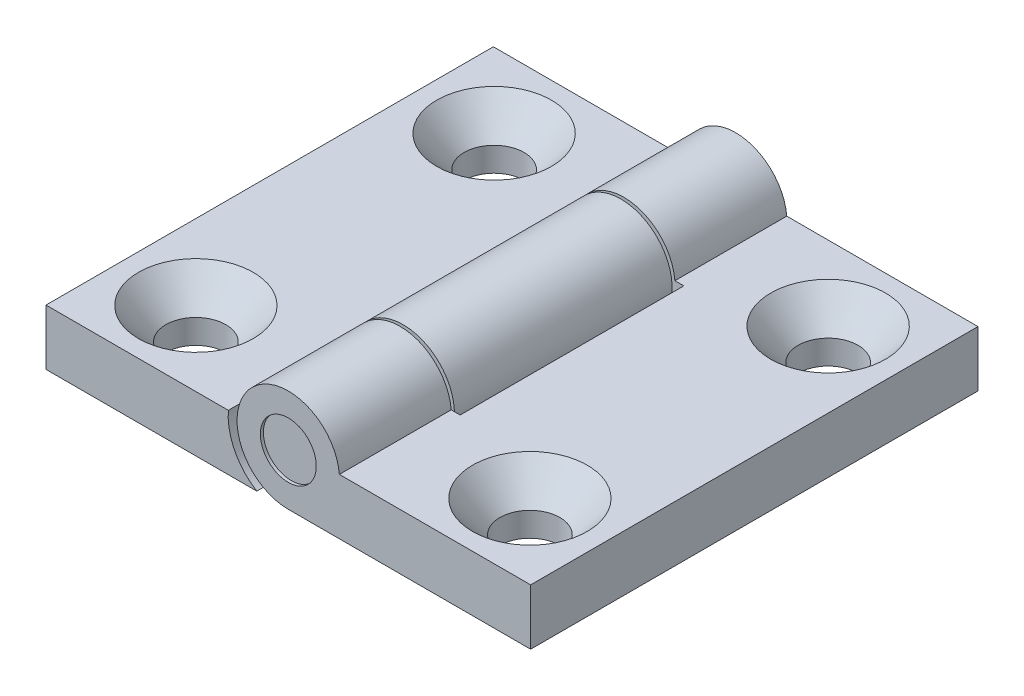
from build123d import *
from build123d.topology import SkipClean

# Parameters (mm, degrees)
SKETCH1_R                                    = 2.38125
EXTRUDE1_DEPTH                               = 19.05
CUT_EXTRUDE1_DEPTH                           = 9.525
CUT_EXTRUDE2_DEPTH                           = 9.525
SKETCH4_W                                    = 10.221376894
SKETCH4_H                                    = 0.254
CUT_EXTRUDE4_DEPTH                           = 30.41162411
SKETCH5_R                                    = 2.38125
EXTRUDE2_DEPTH                               = 18.796
CSK_FOR_10_FLAT_HEAD_MACHINE_SCREW1_AT_COUNT = 2
CSK_FOR_10_FLAT_HEAD_MACHINE_SCREW1_AT_PITCH = 25.4
CSK_FOR_10_FLAT_HEAD_MACHINE_SCREW1_2_COUNT  = 2
CSK_FOR_10_FLAT_HEAD_MACHINE_SCREW1_2_PITCH  = 38.137235138
CSK_FOR_10_FLAT_HEAD_MACHINE_SCREW1_3_COUNT  = 2
CSK_FOR_10_FLAT_HEAD_MACHINE_SCREW1_3_PITCH  = 28.448


with BuildPart() as part:
    # Sketch1 → Extrude1 (new, symmetric)
    with BuildSketch(Plane.XY):
        with BuildLine():
            Line((4.348688447, 4.7498), (20.6375, 4.7498))
            Line((20.6375, 4.7498), (20.6375, 0))
            Line((20.6375, 0), (-20.6375, 0))
            Line((-20.6375, 0), (-20.6375, 4.7498))
            Line((-20.6375, 4.7498), (-4.348688447, 4.7498))
            ThreePointArc((-4.348688447, 4.7498), (0, 8.73125), (4.348688447, 4.7498))
        make_face()
        with Locations(Location((0, 4.365625, 0), (0, 0, 180))):
            Circle(SKETCH1_R, mode=Mode.SUBTRACT)
    extrude(amount=EXTRUDE1_DEPTH, both=True)

    # Sketch2 → Cut-Extrude1 (cut)
    with BuildSketch(Plane.XY.offset(19.05)):
        with BuildLine():
            Line((-5.110688447, 4.7498), (-4.348688447, 4.7498))
            ThreePointArc((-4.348688447, 4.7498), (-3.219925902, 1.417615701), (0, 0))
            Line((0, 0), (-2.684780288, 0))
            ThreePointArc((-2.684780288, 0), (-4.564261518, 2.034478581), (-5.110688447, 4.7498))
        make_face()
    cut_extrude1 = extrude(amount=-CUT_EXTRUDE1_DEPTH, mode=Mode.SUBTRACT)

    # Mirror1: Cut-Extrude1 across plane
    add(cut_extrude1.mirror(Plane.XY), mode=Mode.SUBTRACT)

    # Sketch3 → Cut-Extrude2 (cut, symmetric)
    with SkipClean():  # the faces are left unmerged after this step: merging them gives an invalid solid
        with BuildSketch(Plane.XY):
            with BuildLine():
                Line((4.348688447, 4.7498), (5.110688447, 4.7498))
                ThreePointArc((5.110688447, 4.7498), (4.564261518, 2.034478581), (2.684780288, 0))
                Line((2.684780288, 0), (0, 0))
                ThreePointArc((0, 0), (3.219925902, 1.417615701), (4.348688447, 4.7498))
            make_face()
        extrude(amount=CUT_EXTRUDE2_DEPTH, both=True, mode=Mode.SUBTRACT)

    # Sketch4 → Cut-Extrude4 (cut, through all)
    with SkipClean():  # the faces are left unmerged after this step: merging them gives an invalid solid
        with BuildSketch(Plane(origin=(0, 0, 0), x_dir=(1, 0, 0), z_dir=(0, 1, 0))):
            with Locations((0, 9.398)):
                Rectangle(SKETCH4_W, SKETCH4_H)
            with Locations((0, -9.398)):
                Rectangle(SKETCH4_W, SKETCH4_H)
        extrude(amount=CUT_EXTRUDE4_DEPTH, mode=Mode.SUBTRACT)


with BuildPart() as cut_extrude4_piece_1:
    # of the separate pieces the step leaves, piece 1, a body of its own (cut_extrude4_pieces)
    add(part.part.solids().sort_by_distance((4.348688447, 4.7498, -19.05))[0])


with BuildPart() as cut_extrude4_piece_2:
    # of the separate pieces the step leaves, piece 2, a body of its own (cut_extrude4_pieces)
    add(part.part.solids().sort_by_distance((-4.348688447, 4.7498, -9.271))[0])

    # Sketch6 → CSK for #10 Flat Head Machine Screw1 (revolve, cut)
    with SkipClean():  # the faces are left unmerged after this step: merging them gives an invalid solid
        with BuildSketch(Plane(origin=(-14.224, 4.7498, -12.7), x_dir=(0, 0, 1), z_dir=(1, 0, 0))):
            Polygon((0, 0), (0, 4.7498), (2.5527, 4.7498), (2.5527, 2.688180894), (4.8895, 0), align=None)
        csk_for_10_flat_head_machine_screw1 = revolve(axis=Axis((-14.224, 11.0998, -12.7), (0, -1, 0)), mode=Mode.SUBTRACT)

    # CSK for #10 Flat Head Machine Screw1 at: CSK for #10 Flat Head Machine Screw1 ×2
    with SkipClean():  # the faces are left unmerged after this step: merging them gives an invalid solid
        with Locations(*[(0, 0, i * CSK_FOR_10_FLAT_HEAD_MACHINE_SCREW1_AT_PITCH) for i in range(1, CSK_FOR_10_FLAT_HEAD_MACHINE_SCREW1_AT_COUNT)]):
            add(csk_for_10_flat_head_machine_screw1, mode=Mode.SUBTRACT)


with BuildPart() as body_3:
    # Sketch5 → Extrude2 (new, symmetric)
    with BuildSketch(Plane.XY):
        with Locations((0, 4.365625)):
            Circle(SKETCH5_R)
    extrude(amount=EXTRUDE2_DEPTH, both=True)


with BuildPart() as cut_extrude4_piece_1_1:
    add(cut_extrude4_piece_1.part)

    # CSK for _10 Flat Head Machine Screw1 2: CSK for #10 Flat Head Machine Screw1 ×2
    with Locations(*[Vector(0.7459376616259149, 0, 0.6660157693088522) * (i * CSK_FOR_10_FLAT_HEAD_MACHINE_SCREW1_2_PITCH) for i in range(1, CSK_FOR_10_FLAT_HEAD_MACHINE_SCREW1_2_COUNT)]):
        add(csk_for_10_flat_head_machine_screw1, mode=Mode.SUBTRACT)

    # CSK for _10 Flat Head Machine Screw1 3: CSK for #10 Flat Head Machine Screw1 ×2
    with Locations(*[(i * CSK_FOR_10_FLAT_HEAD_MACHINE_SCREW1_3_PITCH, 0, 0) for i in range(1, CSK_FOR_10_FLAT_HEAD_MACHINE_SCREW1_3_COUNT)]):
        add(csk_for_10_flat_head_machine_screw1, mode=Mode.SUBTRACT)


solid = Compound([cut_extrude4_piece_2.part, body_3.part, cut_extrude4_piece_1_1.part])
